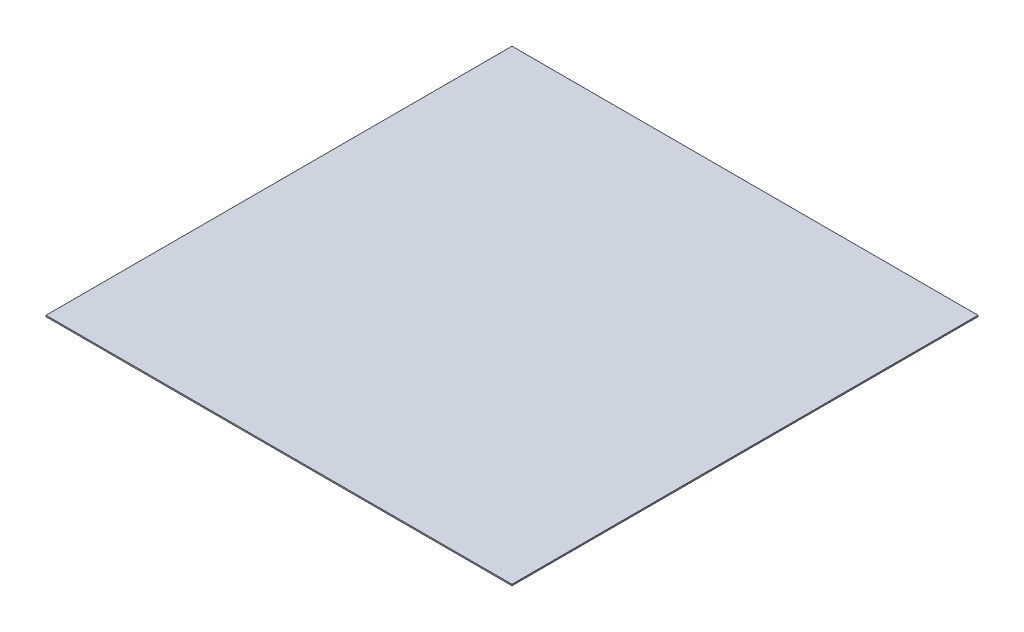
from build123d import *

# Parameters (mm, degrees)
SKETCH1_W           = 914.4
SKETCH1_H           = 914.4
BOSS_EXTRUDE1_DEPTH = 2.54


with BuildPart() as part:
    # Sketch1 → Boss-Extrude1 (new body)
    with BuildSketch(Plane(origin=(0, 0, 0), x_dir=(1, 0, 0), z_dir=(0, 1, 0))):
        with Locations((457.2, 457.2)):
            Rectangle(SKETCH1_W, SKETCH1_H)
    extrude(amount=BOSS_EXTRUDE1_DEPTH)


solid = part.part
